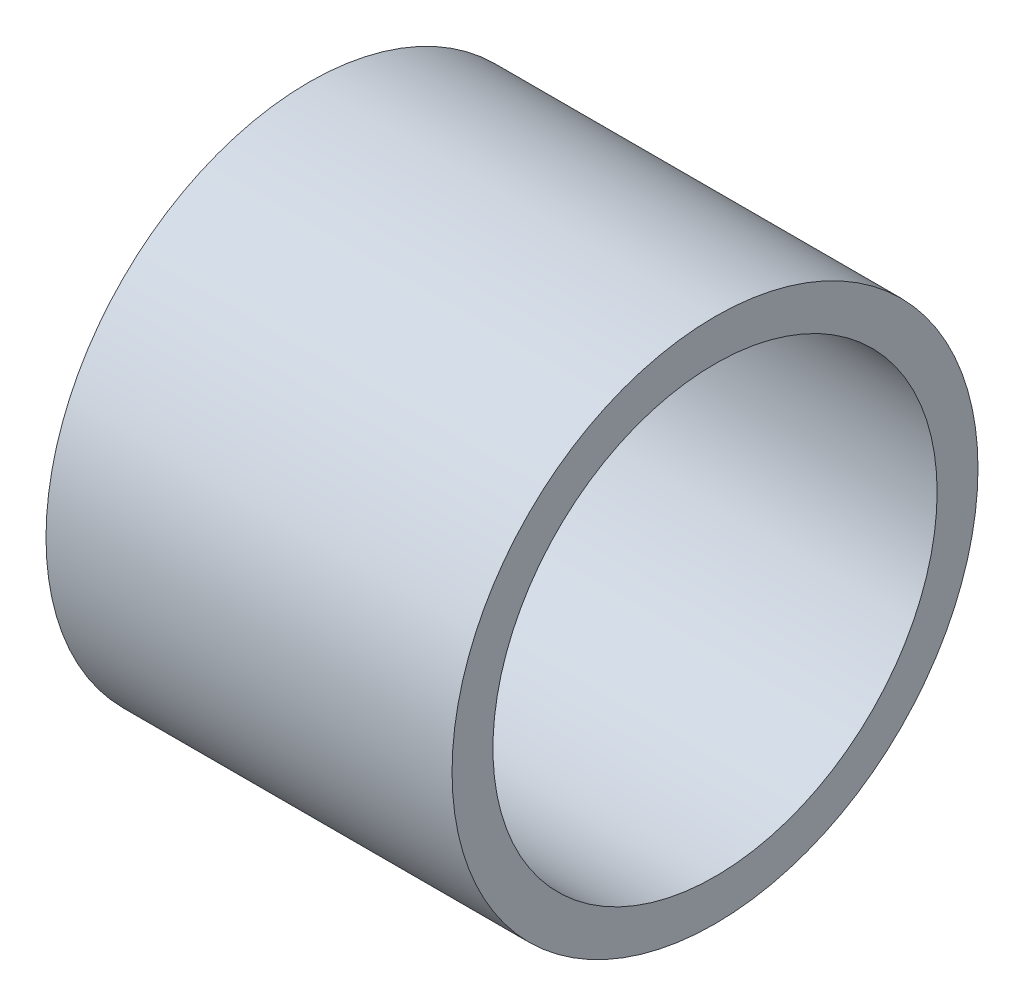
from build123d import *

# Parameters (mm, degrees)
CROQUIS1_R              = 9.65
CROQUIS1_R_2            = 8.15
SALIENTE_EXTRUIR1_DEPTH = 14.9


with BuildPart() as part:
    # Croquis1 → Saliente-Extruir1 (new body)
    with BuildSketch(Plane(origin=(0, 0, 0), x_dir=(0, 0, -1), z_dir=(1, 0, 0))):
        Circle(CROQUIS1_R)
        Circle(CROQUIS1_R_2, mode=Mode.SUBTRACT)
    extrude(amount=-SALIENTE_EXTRUIR1_DEPTH)


solid = part.part
